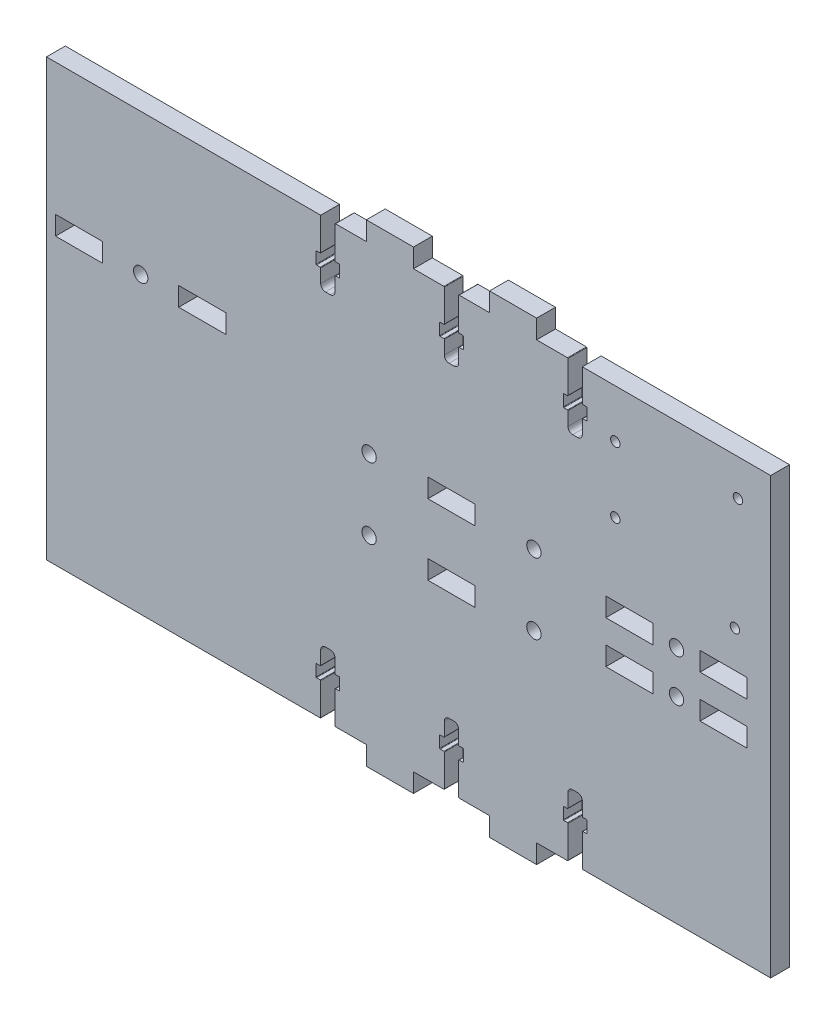
from build123d import *

# Parameters (mm, degrees)
MODEL_R             = 3.05
MODEL_W             = 20
MODEL_H             = 8
MODEL_R_2           = 2
BOSS_EXTRUDE2_DEPTH = 8


with BuildPart() as part:
    # Model → Boss-Extrude2 (new body)
    with BuildSketch(Plane.XY):
        with BuildLine():
            Line((133.05, -78.7), (133.05, -92.3))
            Line((133.05, -92.3), (133.05, -92.5))
            Line((133.05, -92.5), (213.05, -92.5))
            Line((213.05, -92.5), (213.05, 92.3))
            Line((213.05, 92.3), (133.05, 92.3))
            Line((133.05, 92.3), (133.05, 78.7))
            ThreePointArc((133.05, 78.7), (133.108578644, 78.558578644), (133.25, 78.5))
            Line((133.25, 78.5), (134.8, 78.5))
            ThreePointArc((134.8, 78.5), (134.941421356, 78.441421356), (135, 78.3))
            Line((135, 78.3), (135, 73.5))
            ThreePointArc((135, 73.5), (134.941421356, 73.358578644), (134.8, 73.3))
            Line((134.8, 73.3), (133.25, 73.3))
            ThreePointArc((133.25, 73.3), (133.108578644, 73.241421356), (133.05, 73.1))
            Line((133.05, 73.1), (133.05, 67.3))
            ThreePointArc((133.05, 67.3), (132.464213562, 65.885786438), (131.05, 65.3))
            Line((131.05, 65.3), (128.95, 65.3))
            ThreePointArc((128.95, 65.3), (127.535786438, 65.885786438), (126.95, 67.3))
            Line((126.95, 67.3), (126.95, 73.1))
            ThreePointArc((126.95, 73.1), (126.891421356, 73.241421356), (126.75, 73.3))
            Line((126.75, 73.3), (125.2, 73.3))
            ThreePointArc((125.2, 73.3), (125.058578644, 73.358578644), (125, 73.5))
            Line((125, 73.5), (125, 78.3))
            ThreePointArc((125, 78.3), (125.058578644, 78.441421356), (125.2, 78.5))
            Line((125.2, 78.5), (126.75, 78.5))
            ThreePointArc((126.75, 78.5), (126.891421356, 78.558578644), (126.95, 78.7))
            Line((126.95, 78.7), (126.95, 92.3))
            ThreePointArc((126.95, 92.3), (126.891421356, 92.441421356), (126.75, 92.5))
            Line((126.75, 92.5), (113.65, 92.5))
            Line((113.65, 92.5), (113.65, 100.5))
            Line((113.65, 100.5), (93.65, 100.5))
            Line((93.65, 100.5), (93.65, 92.5))
            Line((93.65, 92.5), (80.75, 92.5))
            ThreePointArc((80.75, 92.5), (80.608578644, 92.441421356), (80.55, 92.3))
            Line((80.55, 92.3), (80.55, 78.7))
            ThreePointArc((80.55, 78.7), (80.608578644, 78.558578644), (80.75, 78.5))
            Line((80.75, 78.5), (82.3, 78.5))
            ThreePointArc((82.3, 78.5), (82.441421356, 78.441421356), (82.5, 78.3))
            Line((82.5, 78.3), (82.5, 73.5))
            ThreePointArc((82.5, 73.5), (82.441421356, 73.358578644), (82.3, 73.3))
            Line((82.3, 73.3), (80.75, 73.3))
            ThreePointArc((80.75, 73.3), (80.608578644, 73.241421356), (80.55, 73.1))
            Line((80.55, 73.1), (80.55, 67.3))
            ThreePointArc((80.55, 67.3), (79.964213562, 65.885786438), (78.55, 65.3))
            Line((78.55, 65.3), (76.45, 65.3))
            ThreePointArc((76.45, 65.3), (75.035786438, 65.885786438), (74.45, 67.3))
            Line((74.45, 67.3), (74.45, 73.1))
            ThreePointArc((74.45, 73.1), (74.391421356, 73.241421356), (74.25, 73.3))
            Line((74.25, 73.3), (72.7, 73.3))
            ThreePointArc((72.7, 73.3), (72.558578644, 73.358578644), (72.5, 73.5))
            Line((72.5, 73.5), (72.5, 78.3))
            ThreePointArc((72.5, 78.3), (72.558578644, 78.441421356), (72.7, 78.5))
            Line((72.7, 78.5), (74.25, 78.5))
            ThreePointArc((74.25, 78.5), (74.391421356, 78.558578644), (74.45, 78.7))
            Line((74.45, 78.7), (74.45, 92.3))
            ThreePointArc((74.45, 92.3), (74.391421356, 92.441421356), (74.25, 92.5))
            Line((74.25, 92.5), (61.35, 92.5))
            Line((61.35, 92.5), (61.35, 100.5))
            Line((61.35, 100.5), (41.35, 100.5))
            Line((41.35, 100.5), (41.35, 92.5))
            Line((41.35, 92.5), (28.25, 92.5))
            ThreePointArc((28.25, 92.5), (28.108578644, 92.441421356), (28.05, 92.3))
            Line((28.05, 92.3), (28.05, 78.7))
            ThreePointArc((28.05, 78.7), (28.108578644, 78.558578644), (28.25, 78.5))
            Line((28.25, 78.5), (29.8, 78.5))
            ThreePointArc((29.8, 78.5), (29.941421356, 78.441421356), (30, 78.3))
            Line((30, 78.3), (30, 73.5))
            ThreePointArc((30, 73.5), (29.941421356, 73.358578644), (29.8, 73.3))
            Line((29.8, 73.3), (28.25, 73.3))
            ThreePointArc((28.25, 73.3), (28.108578644, 73.241421356), (28.05, 73.1))
            Line((28.05, 73.1), (28.05, 67.3))
            ThreePointArc((28.05, 67.3), (27.464213562, 65.885786438), (26.05, 65.3))
            Line((26.05, 65.3), (23.95, 65.3))
            ThreePointArc((23.95, 65.3), (22.535786438, 65.885786438), (21.95, 67.3))
            Line((21.95, 67.3), (21.95, 73.1))
            ThreePointArc((21.95, 73.1), (21.891421356, 73.241421356), (21.75, 73.3))
            Line((21.75, 73.3), (20.2, 73.3))
            ThreePointArc((20.2, 73.3), (20.058578644, 73.358578644), (20, 73.5))
            Line((20, 73.5), (20, 78.3))
            ThreePointArc((20, 78.3), (20.058578644, 78.441421356), (20.2, 78.5))
            Line((20.2, 78.5), (21.75, 78.5))
            ThreePointArc((21.75, 78.5), (21.891421356, 78.558578644), (21.95, 78.7))
            Line((21.95, 78.7), (21.95, 92.3))
            Line((21.95, 92.3), (21.95, 92.5))
            Line((21.95, 92.5), (0, 92.5))
            Line((0, 92.5), (-14.5, 92.5))
            Line((-14.5, 92.5), (-94.5, 92.5))
            Line((-94.5, 92.5), (-94.5, 25))
            Line((-94.5, 25), (-94.5, -25))
            Line((-94.5, -25), (-94.5, -92.5))
            Line((-94.5, -92.5), (-14.5, -92.5))
            Line((-14.5, -92.5), (0, -92.5))
            Line((0, -92.5), (21.75, -92.5))
            ThreePointArc((21.75, -92.5), (21.891421356, -92.441421356), (21.95, -92.3))
            Line((21.95, -92.3), (21.95, -78.7))
            ThreePointArc((21.95, -78.7), (21.891421356, -78.558578644), (21.75, -78.5))
            Line((21.75, -78.5), (20.2, -78.5))
            ThreePointArc((20.2, -78.5), (20.058578644, -78.441421356), (20, -78.3))
            Line((20, -78.3), (20, -73.5))
            ThreePointArc((20, -73.5), (20.058578644, -73.358578644), (20.2, -73.3))
            Line((20.2, -73.3), (21.75, -73.3))
            ThreePointArc((21.75, -73.3), (21.891421356, -73.241421356), (21.95, -73.1))
            Line((21.95, -73.1), (21.95, -67.3))
            ThreePointArc((21.95, -67.3), (22.535786438, -65.885786438), (23.95, -65.3))
            Line((23.95, -65.3), (26.05, -65.3))
            ThreePointArc((26.05, -65.3), (27.464213562, -65.885786438), (28.05, -67.3))
            Line((28.05, -67.3), (28.05, -73.1))
            ThreePointArc((28.05, -73.1), (28.108578644, -73.241421356), (28.25, -73.3))
            Line((28.25, -73.3), (29.8, -73.3))
            ThreePointArc((29.8, -73.3), (29.941421356, -73.358578644), (30, -73.5))
            Line((30, -73.5), (30, -78.3))
            ThreePointArc((30, -78.3), (29.941421356, -78.441421356), (29.8, -78.5))
            Line((29.8, -78.5), (28.25, -78.5))
            ThreePointArc((28.25, -78.5), (28.108578644, -78.558578644), (28.05, -78.7))
            Line((28.05, -78.7), (28.05, -92.3))
            ThreePointArc((28.05, -92.3), (28.108578644, -92.441421356), (28.25, -92.5))
            Line((28.25, -92.5), (41.35, -92.5))
            Line((41.35, -92.5), (41.35, -100.5))
            Line((41.35, -100.5), (61.35, -100.5))
            Line((61.35, -100.5), (61.35, -92.5))
            Line((61.35, -92.5), (74.25, -92.5))
            ThreePointArc((74.25, -92.5), (74.391421356, -92.441421356), (74.45, -92.3))
            Line((74.45, -92.3), (74.45, -78.7))
            ThreePointArc((74.45, -78.7), (74.391421356, -78.558578644), (74.25, -78.5))
            Line((74.25, -78.5), (72.7, -78.5))
            ThreePointArc((72.7, -78.5), (72.558578644, -78.441421356), (72.5, -78.3))
            Line((72.5, -78.3), (72.5, -73.5))
            ThreePointArc((72.5, -73.5), (72.558578644, -73.358578644), (72.7, -73.3))
            Line((72.7, -73.3), (74.25, -73.3))
            ThreePointArc((74.25, -73.3), (74.391421356, -73.241421356), (74.45, -73.1))
            Line((74.45, -73.1), (74.45, -67.3))
            ThreePointArc((74.45, -67.3), (75.035786438, -65.885786438), (76.45, -65.3))
            Line((76.45, -65.3), (78.55, -65.3))
            ThreePointArc((78.55, -65.3), (79.964213562, -65.885786438), (80.55, -67.3))
            Line((80.55, -67.3), (80.55, -73.1))
            ThreePointArc((80.55, -73.1), (80.608578644, -73.241421356), (80.75, -73.3))
            Line((80.75, -73.3), (82.3, -73.3))
            ThreePointArc((82.3, -73.3), (82.441421356, -73.358578644), (82.5, -73.5))
            Line((82.5, -73.5), (82.5, -78.3))
            ThreePointArc((82.5, -78.3), (82.441421356, -78.441421356), (82.3, -78.5))
            Line((82.3, -78.5), (80.75, -78.5))
            ThreePointArc((80.75, -78.5), (80.608578644, -78.558578644), (80.55, -78.7))
            Line((80.55, -78.7), (80.55, -92.3))
            ThreePointArc((80.55, -92.3), (80.608578644, -92.441421356), (80.75, -92.5))
            Line((80.75, -92.5), (93.65, -92.5))
            Line((93.65, -92.5), (93.65, -100.5))
            Line((93.65, -100.5), (113.65, -100.5))
            Line((113.65, -100.5), (113.65, -92.5))
            Line((113.65, -92.5), (126.75, -92.5))
            ThreePointArc((126.75, -92.5), (126.891421356, -92.441421356), (126.95, -92.3))
            Line((126.95, -92.3), (126.95, -78.7))
            ThreePointArc((126.95, -78.7), (126.891421356, -78.558578644), (126.75, -78.5))
            Line((126.75, -78.5), (125.2, -78.5))
            ThreePointArc((125.2, -78.5), (125.058578644, -78.441421356), (125, -78.3))
            Line((125, -78.3), (125, -73.5))
            ThreePointArc((125, -73.5), (125.058578644, -73.358578644), (125.2, -73.3))
            Line((125.2, -73.3), (126.75, -73.3))
            ThreePointArc((126.75, -73.3), (126.891421356, -73.241421356), (126.95, -73.1))
            Line((126.95, -73.1), (126.95, -67.3))
            ThreePointArc((126.95, -67.3), (127.535786438, -65.885786438), (128.95, -65.3))
            Line((128.95, -65.3), (131.05, -65.3))
            ThreePointArc((131.05, -65.3), (132.464213562, -65.885786438), (133.05, -67.3))
            Line((133.05, -67.3), (133.05, -73.1))
            ThreePointArc((133.05, -73.1), (133.108578644, -73.241421356), (133.25, -73.3))
            Line((133.25, -73.3), (134.8, -73.3))
            ThreePointArc((134.8, -73.3), (134.941421356, -73.358578644), (135, -73.5))
            Line((135, -73.5), (135, -78.3))
            ThreePointArc((135, -78.3), (134.941421356, -78.441421356), (134.8, -78.5))
            Line((134.8, -78.5), (133.25, -78.5))
            ThreePointArc((133.25, -78.5), (133.108578644, -78.558578644), (133.05, -78.7))
        make_face()
        with Locations((42.5, -15)):
            Circle(MODEL_R, mode=Mode.SUBTRACT)
        with Locations((77.5, -15)):
            Rectangle(MODEL_W, MODEL_H, mode=Mode.SUBTRACT)
        with Locations((112.5, -15)):
            Circle(MODEL_R, mode=Mode.SUBTRACT)
        with Locations((153.05, -9)):
            Rectangle(MODEL_W, MODEL_H, mode=Mode.SUBTRACT)
        with Locations((173.05, -9)):
            Circle(MODEL_R, mode=Mode.SUBTRACT)
        with Locations((193.05, -9)):
            Rectangle(MODEL_W, MODEL_H, mode=Mode.SUBTRACT)
        with Locations((-80.65, 32.5)):
            Rectangle(MODEL_W, MODEL_H, mode=Mode.SUBTRACT)
        with Locations((-54.5, 32.5)):
            Circle(MODEL_R, mode=Mode.SUBTRACT)
        with Locations((-28.35, 32.5)):
            Rectangle(MODEL_W, MODEL_H, mode=Mode.SUBTRACT)
        with Locations((42.5, 15)):
            Circle(MODEL_R, mode=Mode.SUBTRACT)
        with Locations((77.5, 15)):
            Rectangle(MODEL_W, MODEL_H, mode=Mode.SUBTRACT)
        with Locations((112.5, 15)):
            Circle(MODEL_R, mode=Mode.SUBTRACT)
        with Locations((153.05, 9)):
            Rectangle(MODEL_W, MODEL_H, mode=Mode.SUBTRACT)
        with Locations((173.05, 9)):
            Circle(MODEL_R, mode=Mode.SUBTRACT)
        with Locations((193.05, 9)):
            Rectangle(MODEL_W, MODEL_H, mode=Mode.SUBTRACT)
        with Locations((147.071572927, 43.86)):
            Circle(MODEL_R_2, mode=Mode.SUBTRACT)
        with Locations((197.871572927, 28.62)):
            Circle(MODEL_R_2, mode=Mode.SUBTRACT)
        with Locations((147.071572927, 71.8)):
            Circle(MODEL_R_2, mode=Mode.SUBTRACT)
        with Locations((199.141572927, 76.88)):
            Circle(MODEL_R_2, mode=Mode.SUBTRACT)
    extrude(amount=BOSS_EXTRUDE2_DEPTH)


solid = part.part
